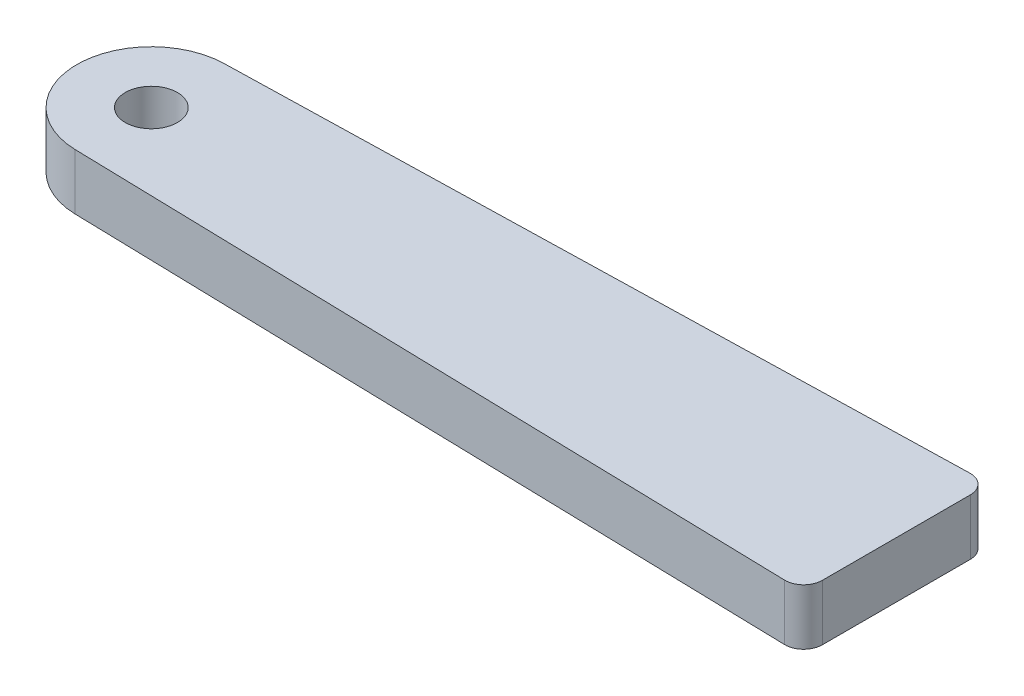
from build123d import *

# Parameters (mm, degrees)
SKETCH1_R           = 1.4
BOSS_EXTRUDE1_DEPTH = 3


with BuildPart() as part:
    # Sketch1 → Boss-Extrude1 (new body)
    with BuildSketch(Plane(origin=(0, 0, 0), x_dir=(1, 0, 0), z_dir=(0, 1, 0))):
        with BuildLine():
            Line((0, -1.025278455), (0, -8.974734883))
            ThreePointArc((0, -8.974734883), (-0.301768682, -9.690607097), (-1.024946053, -9.974423682))
            Line((-1.024946053, -9.974423682), (-40.099818721, -8.999356383))
            ThreePointArc((-40.099818721, -8.999356383), (-44.000366387, -5.000286937), (-40.099870732, -1.001166763))
            Line((-40.099870732, -1.001166763), (-1.024959055, -0.025589981))
            ThreePointArc((-1.024959055, -0.025589981), (-0.301773337, -0.309401701), (0, -1.025278455))
        make_face()
        with Locations(Location((-40.000026017, -5.000260924, 0), (0, 0, 270))):
            Circle(SKETCH1_R, mode=Mode.SUBTRACT)
    extrude(amount=BOSS_EXTRUDE1_DEPTH)


solid = part.part
